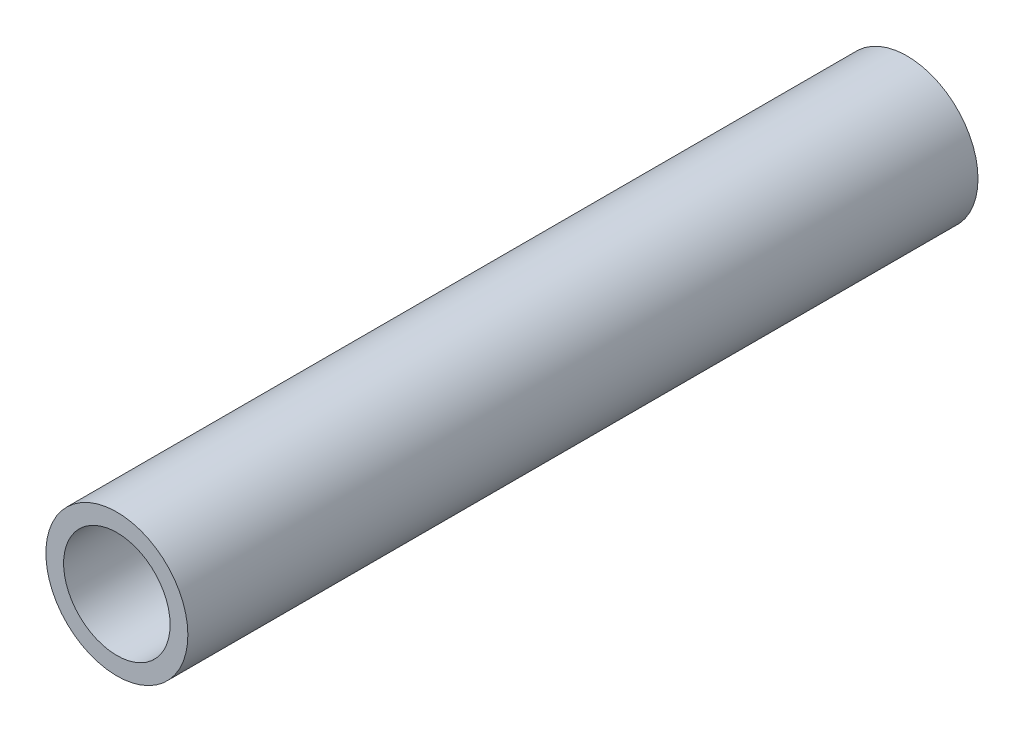
from build123d import *

# Parameters (mm, degrees)
SKETCH1_R           = 20
BOSS_EXTRUDE1_DEPTH = 222.57
SKETCH2_R           = 15
CUT_EXTRUDE1_DEPTH  = 225.359989526


with BuildPart() as part:
    # Sketch1 → Boss-Extrude1 (new body)
    with BuildSketch(Plane.XY):
        Circle(SKETCH1_R)
    extrude(amount=BOSS_EXTRUDE1_DEPTH)

    # Sketch2 → Cut-Extrude1 (cut, through all)
    with BuildSketch(Plane.XY.offset(222.57)):
        Circle(SKETCH2_R)
    extrude(amount=-CUT_EXTRUDE1_DEPTH, mode=Mode.SUBTRACT)


solid = part.part
